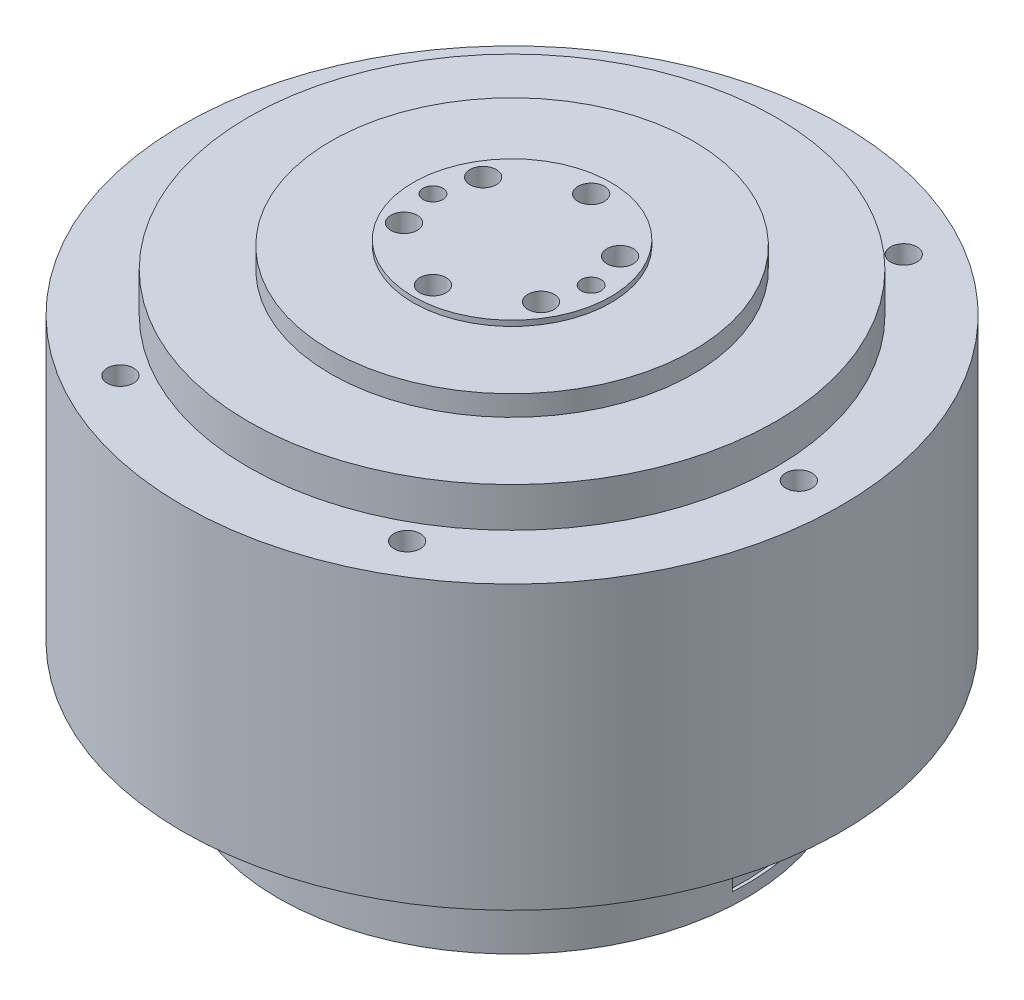
from build123d import *

# Parameters (mm, degrees)
SKETCH2_R                = 35.5
BOSS_EXTRUDE1_DEPTH      = 16
SKETCH3_R                = 50
BOSS_EXTRUDE2_DEPTH      = 42.86
SKETCH4_R                = 40
BOSS_EXTRUDE3_DEPTH      = 6
SKETCH5_R                = 27.5
BOSS_EXTRUDE4_DEPTH      = 3.1
SKETCH6_R                = 15
BOSS_EXTRUDE5_DEPTH      = 0.82
SKETCH7_R                = 1.5
CUT_EXTRUDE1_DEPTH       = 3
SKETCH8_R                = 2
CUT_EXTRUDE2_DEPTH       = 8
SKETCH9_R                = 2
CUT_EXTRUDE3_DEPTH       = 8.5
CUT_EXTRUDE4_START       = -4.5
SKETCH10_R               = 2
CUT_EXTRUDE4_DEPTH       = 4.5
SKETCH12_W               = 22
SKETCH12_H               = 11
CUT_EXTRUDE6_DEPTH       = 54.5
BOSS_EXTRUDE6_REACH      = 100.644
BOSS_EXTRUDE6_END_RADIUS = 35


with BuildPart() as part:
    # Sketch2 → Boss-Extrude1 (new body)
    with BuildSketch(Plane(origin=(0, 0, 0), x_dir=(1, 0, 0), z_dir=(0, 1, 0))):
        with Locations(Location((0, 0, 0), (0, 0, 270))):
            Circle(SKETCH2_R)
    extrude(amount=BOSS_EXTRUDE1_DEPTH)

    # Sketch3 → Boss-Extrude2 (add)
    with BuildSketch(Plane(origin=(0, 16, 0), x_dir=(1, 0, 0), z_dir=(0, 1, 0))):
        with Locations(Location((0, 0, 0), (0, 0, 270))):
            Circle(SKETCH3_R)
    extrude(amount=BOSS_EXTRUDE2_DEPTH)

    # Sketch4 → Boss-Extrude3 (add)
    with BuildSketch(Plane(origin=(0, 58.86, 0), x_dir=(1, 0, 0), z_dir=(0, 1, 0))):
        with Locations(Location((0, 0, 0), (0, 0, 270))):
            Circle(SKETCH4_R)
    extrude(amount=BOSS_EXTRUDE3_DEPTH)

    # Sketch5 → Boss-Extrude4 (add)
    with BuildSketch(Plane(origin=(0, 64.86, 0), x_dir=(1, 0, 0), z_dir=(0, 1, 0))):
        with Locations(Location((0, 0, 0), (0, 0, 90))):
            Circle(SKETCH5_R)
    extrude(amount=BOSS_EXTRUDE4_DEPTH)

    # Sketch6 → Boss-Extrude5 (add)
    with BuildSketch(Plane(origin=(0, 67.96, 0), x_dir=(1, 0, 0), z_dir=(0, 1, 0))):
        with Locations(Location((0, 0, 0), (0, 0, 270))):
            Circle(SKETCH6_R)
    extrude(amount=BOSS_EXTRUDE5_DEPTH)

    # Sketch7 → Cut-Extrude1 (cut)
    with BuildSketch(Plane(origin=(0, 68.78, 0), x_dir=(1, 0, 0), z_dir=(0, 1, 0))):
        with Locations(Location((12, 0, 0), (0, 0, 270))):
            Circle(SKETCH7_R)
        with Locations(Location((-12, 0, 0), (0, 0, 270))):
            Circle(SKETCH7_R)
    extrude(amount=-CUT_EXTRUDE1_DEPTH, mode=Mode.SUBTRACT)

    # Sketch8 → Cut-Extrude2 (cut)
    with BuildSketch(Plane(origin=(0, 68.78, 0), x_dir=(1, 0, 0), z_dir=(0, 1, 0))):
        with Locations(Location((10.392304845, -6, 0), (0, 0, 270))):
            Circle(SKETCH8_R)
        with Locations(Location((0, -12, 0), (0, 0, 270))):
            Circle(SKETCH8_R)
        with Locations(Location((-10.392304845, -6, 0), (0, 0, 270))):
            Circle(SKETCH8_R)
        with Locations(Location((-10.392304845, 6, 0), (0, 0, 270))):
            Circle(SKETCH8_R)
        with Locations(Location((0, 12, 0), (0, 0, 270))):
            Circle(SKETCH8_R)
        with Locations(Location((10.392304845, 6, 0), (0, 0, 270))):
            Circle(SKETCH8_R)
    extrude(amount=-CUT_EXTRUDE2_DEPTH, mode=Mode.SUBTRACT)

    # Sketch9 → Cut-Extrude3 (cut)
    with BuildSketch(Plane(origin=(0, 58.86, 0), x_dir=(1, 0, 0), z_dir=(0, 1, 0))):
        with Locations(Location((43.5, 0, 0), (0, 0, 270))):
            Circle(SKETCH9_R)
        with Locations(Location((21.75, -37.672105065, 0), (0, 0, 270))):
            Circle(SKETCH9_R)
        with Locations(Location((-21.75, -37.672105065, 0), (0, 0, 270))):
            Circle(SKETCH9_R)
        with Locations(Location((-43.5, 0, 0), (0, 0, 270))):
            Circle(SKETCH9_R)
        with Locations(Location((-21.75, 37.672105065, 0), (0, 0, 270))):
            Circle(SKETCH9_R)
        with Locations(Location((21.75, 37.672105065, 0), (0, 0, 270))):
            Circle(SKETCH9_R)
    extrude(amount=-CUT_EXTRUDE3_DEPTH, mode=Mode.SUBTRACT)

    # Sketch10 → Cut-Extrude4 (cut)
    with BuildSketch(Plane.XZ.offset(-16).offset(CUT_EXTRUDE4_START)):
        with Locations(Location((-43.5, 0, 0), (0, 0, 90))):
            Circle(SKETCH10_R)
        with Locations(Location((-21.75, 37.672105065, 0), (0, 0, 90))):
            Circle(SKETCH10_R)
        with Locations(Location((21.75, 37.672105065, 0), (0, 0, 90))):
            Circle(SKETCH10_R)
        with Locations(Location((43.5, 0, 0), (0, 0, 90))):
            Circle(SKETCH10_R)
        with Locations(Location((21.75, -37.672105065, 0), (0, 0, 90))):
            Circle(SKETCH10_R)
        with Locations(Location((-21.75, -37.672105065, 0), (0, 0, 90))):
            Circle(SKETCH10_R)
    extrude(amount=CUT_EXTRUDE4_DEPTH, mode=Mode.SUBTRACT)

    # Sketch12 → Cut-Extrude6 (cut)
    with BuildSketch(Plane(origin=(0, 0, 0), x_dir=(0, 0, -1), z_dir=(1, 0, 0))):
        with Locations((9, 7.3)):
            Rectangle(SKETCH12_W, SKETCH12_H)
    extrude(amount=CUT_EXTRUDE6_DEPTH, mode=Mode.SUBTRACT)

    # Boss-Extrude6: up to this cylinder (the profile starts inside it)
    boss_extrude6_end = Plane(origin=(0, 6.970651, 0), z_dir=(0, -1, 0)) * Cylinder(BOSS_EXTRUDE6_END_RADIUS, 272.288, mode=Mode.PRIVATE)
    # Sketch13 → Boss-Extrude6 (add, up to the surface)
    with BuildSketch(Plane(origin=(0, 0, 0), x_dir=(0, 0, -1), z_dir=(1, 0, 0)), mode=Mode.PRIVATE) as boss_extrude6_sk1:
        with BuildLine():
            Line((1.425115379, 10.619463885), (1.425115379, 12.8))
            Line((1.425115379, 12.8), (12.035760987, 12.8))
            Line((12.035760987, 12.8), (12.035760987, 11.49))
            ThreePointArc((12.035760987, 11.49), (13.345760987, 10.18), (14.655760987, 11.49))
            Line((14.655760987, 11.49), (14.655760987, 12.8))
            Line((14.655760987, 12.8), (20, 12.8))
            Line((20, 12.8), (20, 1.8))
            Line((20, 1.8), (-2, 1.8))
            Line((-2, 1.8), (-2, 9.216236834))
            ThreePointArc((-2, 9.216236834), (0.183326841, 8.768757161), (1.425115379, 10.619463885))
        make_face()
    boss_extrude6_tool1 = extrude(boss_extrude6_sk1.sketch, amount=BOSS_EXTRUDE6_REACH, mode=Mode.PRIVATE) & boss_extrude6_end
    add(boss_extrude6_tool1.solids().sort_by_distance((0, 6.970651, -9.434063))[0])


solid = part.part
